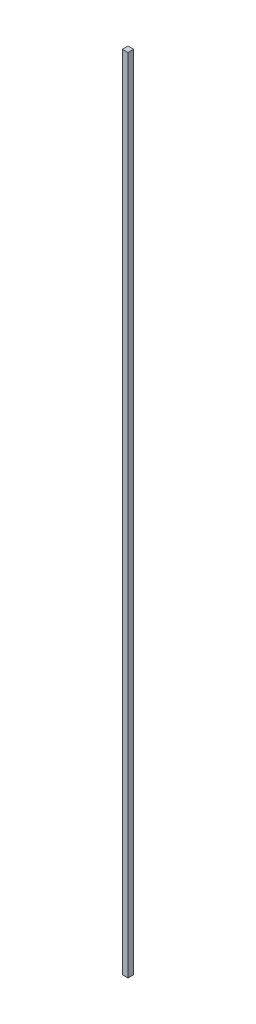
from build123d import *

# Parameters (mm, degrees)
SKETCH1_W           = 4
SKETCH1_H           = 570
BOSS_EXTRUDE1_DEPTH = 4


with BuildPart() as part:
    # Sketch1 → Boss-Extrude1 (new body)
    with BuildSketch(Plane.XY):
        with Locations((2, 285)):
            Rectangle(SKETCH1_W, SKETCH1_H)
    extrude(amount=BOSS_EXTRUDE1_DEPTH)


solid = part.part
